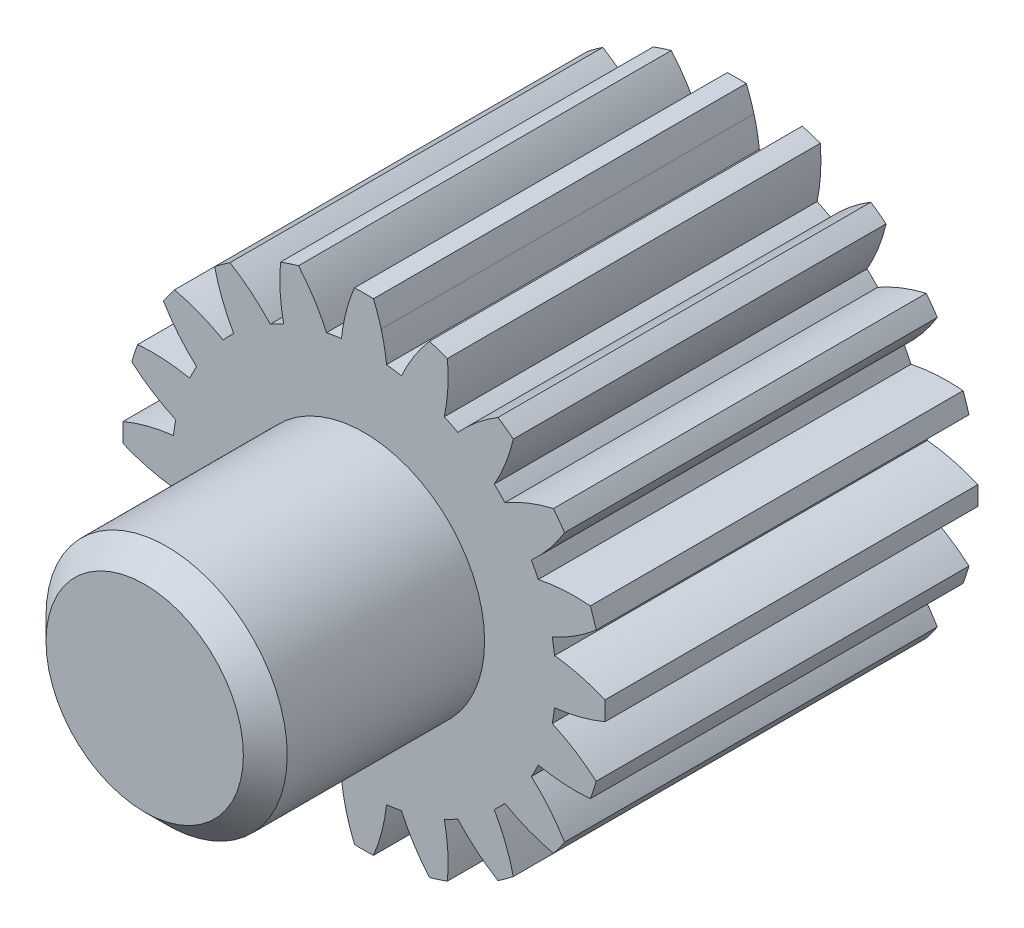
from build123d import *

# Parameters (mm, degrees)
AUFSATZ_LINEAR_AUSTRAGEN1_DEPTH = 17
SKIZZE2_R                       = 5.5
AUFSATZ_LINEAR_AUSTRAGEN3_DEPTH = 10
FASE1_SIZE                      = 1


with BuildPart() as part:
    # Skizze1 → Aufsatz-Linear austragen1 (new body)
    with BuildSketch(Plane.XY.offset(14.999999972)):
        with BuildLine():
            ThreePointArc((-1.707040323, 8.581871229), (-2.274158717, 9.63053951), (-2.985844941, 10.587007573))
            ThreePointArc((-2.985844941, 10.587007573), (-3.399186929, 10.461621652), (-3.807287618, 10.320104668))
            ThreePointArc((-3.807287618, 10.320104668), (-3.820856046, 9.127987084), (-3.663272714, 7.946252795))
            ThreePointArc((-3.663272714, 7.946252795), (-3.972416885, 7.79630711), (-4.275435876, 7.634340085))
            ThreePointArc((-4.275435876, 7.634340085), (-5.138853841, 8.456433665), (-6.111272547, 9.146165711))
            ThreePointArc((-6.111272547, 9.146165711), (-6.465637758, 8.899186915), (-6.810033424, 8.638486217))
            ThreePointArc((-6.810033424, 8.638486217), (-6.454553173, 7.500522146), (-5.939506541, 6.425321977))
            ThreePointArc((-5.939506541, 6.425321977), (-6.187184354, 6.187184354), (-6.425321977, 5.939506541))
            ThreePointArc((-6.425321977, 5.939506541), (-7.500522146, 6.454553173), (-8.638486217, 6.810033424))
            ThreePointArc((-8.638486217, 6.810033424), (-8.899186915, 6.465637758), (-9.146165711, 6.111272547))
            ThreePointArc((-9.146165711, 6.111272547), (-8.456433665, 5.138853841), (-7.634340085, 4.275435876))
            ThreePointArc((-7.634340085, 4.275435876), (-7.79630711, 3.972416885), (-7.946252795, 3.663272714))
            ThreePointArc((-7.946252795, 3.663272714), (-9.127987084, 3.820856046), (-10.320104668, 3.807287618))
            ThreePointArc((-10.320104668, 3.807287618), (-10.461621652, 3.399186929), (-10.587007573, 2.985844941))
            ThreePointArc((-10.587007573, 2.985844941), (-9.63053951, 2.274158717), (-8.581871229, 1.707040323))
            ThreePointArc((-8.581871229, 1.707040323), (-8.642273006, 1.368801573), (-8.689349024, 1.028452231))
            ThreePointArc((-8.689349024, 1.028452231), (-9.861941048, 0.813146907), (-10.99151937, 0.431857972))
            ThreePointArc((-10.99151937, 0.431857972), (-10.999999971, 0), (-10.99151937, -0.431857972))
            ThreePointArc((-10.99151937, -0.431857972), (-9.861941048, -0.813146907), (-8.689349024, -1.028452231))
            ThreePointArc((-8.689349024, -1.028452231), (-8.642273006, -1.368801573), (-8.581871229, -1.707040323))
            ThreePointArc((-8.581871229, -1.707040323), (-9.63053951, -2.274158717), (-10.587007573, -2.985844941))
            ThreePointArc((-10.587007573, -2.985844941), (-10.461621652, -3.399186929), (-10.320104668, -3.807287618))
            ThreePointArc((-10.320104668, -3.807287618), (-9.127987084, -3.820856046), (-7.946252795, -3.663272714))
            ThreePointArc((-7.946252795, -3.663272714), (-7.79630711, -3.972416885), (-7.634340085, -4.275435876))
            ThreePointArc((-7.634340085, -4.275435876), (-8.456433665, -5.138853841), (-9.146165711, -6.111272547))
            ThreePointArc((-9.146165711, -6.111272547), (-8.899186915, -6.465637758), (-8.638486217, -6.810033424))
            ThreePointArc((-8.638486217, -6.810033424), (-7.500522146, -6.454553173), (-6.425321977, -5.939506541))
            ThreePointArc((-6.425321977, -5.939506541), (-6.187184354, -6.187184354), (-5.939506541, -6.425321977))
            ThreePointArc((-5.939506541, -6.425321977), (-6.454553173, -7.500522146), (-6.810033424, -8.638486217))
            ThreePointArc((-6.810033424, -8.638486217), (-6.465637758, -8.899186915), (-6.111272547, -9.146165711))
            ThreePointArc((-6.111272547, -9.146165711), (-5.138853841, -8.456433665), (-4.275435876, -7.634340085))
            ThreePointArc((-4.275435876, -7.634340085), (-3.972416885, -7.79630711), (-3.663272714, -7.946252795))
            ThreePointArc((-3.663272714, -7.946252795), (-3.820856046, -9.127987084), (-3.807287618, -10.320104668))
            ThreePointArc((-3.807287618, -10.320104668), (-3.399186929, -10.461621652), (-2.985844941, -10.587007573))
            ThreePointArc((-2.985844941, -10.587007573), (-2.274158717, -9.63053951), (-1.707040323, -8.581871229))
            ThreePointArc((-1.707040323, -8.581871229), (-1.368801573, -8.642273006), (-1.028452231, -8.689349024))
            ThreePointArc((-1.028452231, -8.689349024), (-0.813146907, -9.861941048), (-0.431857972, -10.99151937))
            ThreePointArc((-0.431857972, -10.99151937), (0, -10.999999971), (0.431857972, -10.99151937))
            ThreePointArc((0.431857972, -10.99151937), (0.813146907, -9.861941048), (1.028452231, -8.689349024))
            ThreePointArc((1.028452231, -8.689349024), (1.368801573, -8.642273006), (1.707040323, -8.581871229))
            ThreePointArc((1.707040323, -8.581871229), (2.274158717, -9.63053951), (2.985844941, -10.587007573))
            ThreePointArc((2.985844941, -10.587007573), (3.399186929, -10.461621652), (3.807287618, -10.320104668))
            ThreePointArc((3.807287618, -10.320104668), (3.820856046, -9.127987084), (3.663272714, -7.946252795))
            ThreePointArc((3.663272714, -7.946252795), (3.972416885, -7.79630711), (4.275435876, -7.634340085))
            ThreePointArc((4.275435876, -7.634340085), (5.138853841, -8.456433665), (6.111272547, -9.146165711))
            ThreePointArc((6.111272547, -9.146165711), (6.465637758, -8.899186915), (6.810033424, -8.638486217))
            ThreePointArc((6.810033424, -8.638486217), (6.454553173, -7.500522146), (5.939506541, -6.425321977))
            ThreePointArc((5.939506541, -6.425321977), (6.187184354, -6.187184354), (6.425321977, -5.939506541))
            ThreePointArc((6.425321977, -5.939506541), (7.500522146, -6.454553173), (8.638486217, -6.810033424))
            ThreePointArc((8.638486217, -6.810033424), (8.899186915, -6.465637758), (9.146165711, -6.111272547))
            ThreePointArc((9.146165711, -6.111272547), (8.456433665, -5.138853841), (7.634340085, -4.275435876))
            ThreePointArc((7.634340085, -4.275435876), (7.79630711, -3.972416885), (7.946252795, -3.663272714))
            ThreePointArc((7.946252795, -3.663272714), (9.127987084, -3.820856046), (10.320104668, -3.807287618))
            ThreePointArc((10.320104668, -3.807287618), (10.461621652, -3.399186929), (10.587007573, -2.985844941))
            ThreePointArc((10.587007573, -2.985844941), (9.63053951, -2.274158717), (8.581871229, -1.707040323))
            ThreePointArc((8.581871229, -1.707040323), (8.642273006, -1.368801573), (8.689349024, -1.028452231))
            ThreePointArc((8.689349024, -1.028452231), (9.861941048, -0.813146907), (10.99151937, -0.431857972))
            ThreePointArc((10.99151937, -0.431857972), (10.999999971, 0), (10.99151937, 0.431857972))
            ThreePointArc((10.99151937, 0.431857972), (9.861941048, 0.813146907), (8.689349024, 1.028452231))
            ThreePointArc((8.689349024, 1.028452231), (8.642273006, 1.368801573), (8.581871229, 1.707040323))
            ThreePointArc((8.581871229, 1.707040323), (9.63053951, 2.274158717), (10.587007573, 2.985844941))
            ThreePointArc((10.587007573, 2.985844941), (10.461621652, 3.399186929), (10.320104668, 3.807287618))
            ThreePointArc((10.320104668, 3.807287618), (9.127987084, 3.820856046), (7.946252795, 3.663272714))
            ThreePointArc((7.946252795, 3.663272714), (7.79630711, 3.972416885), (7.634340085, 4.275435876))
            ThreePointArc((7.634340085, 4.275435876), (8.456433665, 5.138853841), (9.146165711, 6.111272547))
            ThreePointArc((9.146165711, 6.111272547), (8.899186915, 6.465637758), (8.638486217, 6.810033424))
            ThreePointArc((8.638486217, 6.810033424), (7.500522146, 6.454553173), (6.425321977, 5.939506541))
            ThreePointArc((6.425321977, 5.939506541), (6.187184354, 6.187184354), (5.939506541, 6.425321977))
            ThreePointArc((5.939506541, 6.425321977), (6.454553173, 7.500522146), (6.810033424, 8.638486217))
            ThreePointArc((6.810033424, 8.638486217), (6.465637758, 8.899186915), (6.111272547, 9.146165711))
            ThreePointArc((6.111272547, 9.146165711), (5.138853841, 8.456433665), (4.275435876, 7.634340085))
            ThreePointArc((4.275435876, 7.634340085), (3.972416885, 7.79630711), (3.663272714, 7.946252795))
            ThreePointArc((3.663272714, 7.946252795), (3.820856046, 9.127987084), (3.807287618, 10.320104668))
            ThreePointArc((3.807287618, 10.320104668), (3.399186929, 10.461621652), (2.985844941, 10.587007573))
            ThreePointArc((2.985844941, 10.587007573), (2.274158717, 9.63053951), (1.707040323, 8.581871229))
            ThreePointArc((1.707040323, 8.581871229), (1.368801573, 8.642273006), (1.028452231, 8.689349024))
            ThreePointArc((1.028452231, 8.689349024), (0.813146907, 9.861941048), (0.431857972, 10.99151937))
            ThreePointArc((0.431857972, 10.99151937), (0, 10.999999971), (-0.431857972, 10.99151937))
            ThreePointArc((-0.431857972, 10.99151937), (-0.813146907, 9.861941048), (-1.028452231, 8.689349024))
            ThreePointArc((-1.028452231, 8.689349024), (-1.368801573, 8.642273006), (-1.707040323, 8.581871229))
        make_face()
    extrude(amount=-AUFSATZ_LINEAR_AUSTRAGEN1_DEPTH)

    # Skizze2 → Aufsatz-Linear austragen3 (add)
    with BuildSketch(Plane.XY.offset(14.999999972)):
        Circle(SKIZZE2_R)
    extrude(amount=AUFSATZ_LINEAR_AUSTRAGEN3_DEPTH)

    # Fase1
    fase1_edges = [part.edges().sort_by_distance(p)[0] for p in [
        (-5.5, 0, 24.999999972),
    ]]
    chamfer(fase1_edges, length=FASE1_SIZE)


solid = part.part
